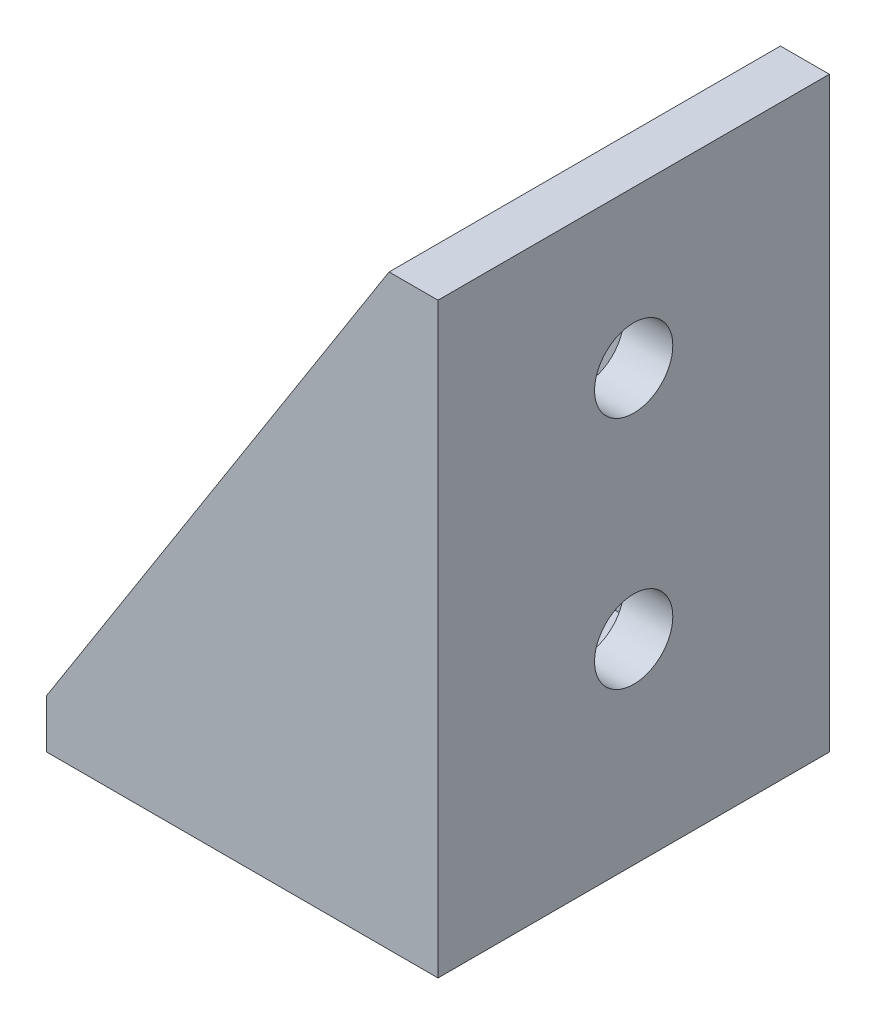
from build123d import *

# Parameters (mm, degrees)
EXTRUDE_1_DEPTH     = 20
CUT_EXTRUDE_START   = 30
SKETCH_2_W          = 17.5
SKETCH_2_H          = 16.6
CUT_EXTRUDE_1_DEPTH = 27.5
CUT_EXTRUDE_START_2 = 17.5
SKETCH_3_R          = 2
CUT_EXTRUDE_2_DEPTH = 2.5
CUT_EXTRUDE_3_REACH = 43.231
SKETCH_4_R          = 1.7


with BuildPart() as part:
    # 草图1 → 凸台-拉伸1 (new body)
    with BuildSketch(Plane.XY):
        Polygon((0, 0), (20, 0), (20, 30), (17.5, 30), (0, 2.5), align=None)
    extrude(amount=-EXTRUDE_1_DEPTH)

    # 草图2 → 切除-拉伸1 (cut)
    with BuildSketch(Plane(origin=(0, 0, 0), x_dir=(1, 0, 0), z_dir=(0, 1, 0)).offset(CUT_EXTRUDE_START)):
        with Locations((8.75, 10)):
            Rectangle(SKETCH_2_W, SKETCH_2_H)
    extrude(amount=-CUT_EXTRUDE_1_DEPTH, mode=Mode.SUBTRACT)

    # 草图3 → 切除-拉伸2 (cut)
    with BuildSketch(Plane(origin=(0, 0, 0), x_dir=(0, 0, -1), z_dir=(1, 0, 0)).offset(CUT_EXTRUDE_START_2)):
        with Locations(Location((10, 22, 0), (0, 0, 180))):
            Circle(SKETCH_3_R)
        with Locations(Location((10, 10, 0), (0, 0, 180))):
            Circle(SKETCH_3_R)
    extrude(amount=CUT_EXTRUDE_2_DEPTH, mode=Mode.SUBTRACT)

    # 草图4 → 切除-拉伸3 (cut, up to next)
    with BuildSketch(Plane(origin=(0, 0, 0), x_dir=(1, 0, 0), z_dir=(0, 1, 0)), mode=Mode.PRIVATE) as cut_extrude_3_sk1:
        with Locations(Location((9, 10, 0), (0, 0, 90))):
            Circle(SKETCH_4_R)
    cut_extrude_3_tool1 = extrude(cut_extrude_3_sk1.sketch, amount=CUT_EXTRUDE_3_REACH, mode=Mode.PRIVATE) & part.part
    add(cut_extrude_3_tool1.solids().sort_by_distance((9, 0, -10))[0], mode=Mode.SUBTRACT)


solid = part.part
